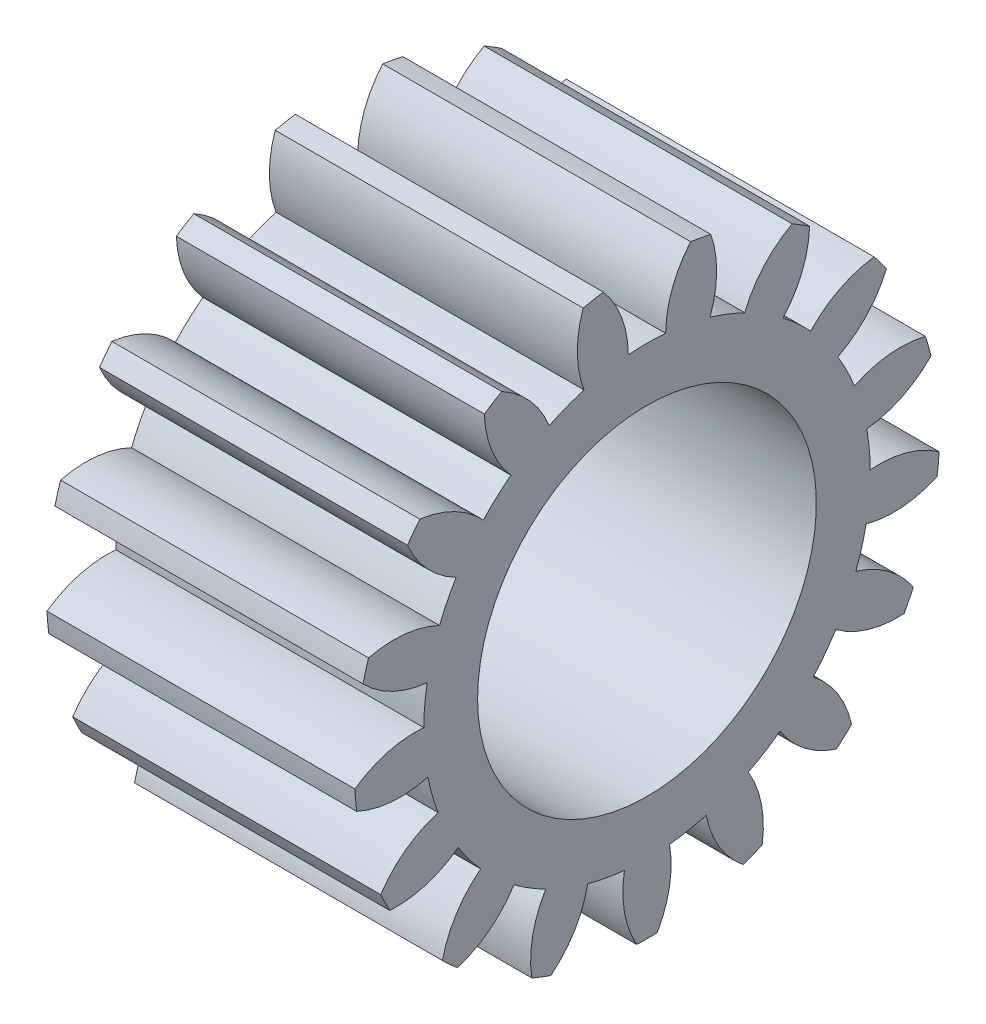
from build123d import *

# Parameters (mm, degrees)
BASPROSKE_W     = 10
BASPROSKE_H     = 9.5
TOOTHCUT_DEPTH  = 17.748134224
TEETHCUTS_COUNT = 17
TEETHCUTS_ANGLE = 338.823529412
BORSKE_R        = 5.5
BORE_DEPTH      = 50.0000508


with BuildPart() as part:
    # BasProSke → Base-Revolve (revolve)
    with BuildSketch(Plane(origin=(0, 0, 0), x_dir=(1, 0, 0), z_dir=(0, 1, 0)), mode=Mode.PRIVATE) as base_revolve_sk:
        with Locations((5, 4.75)):
            Rectangle(BASPROSKE_W, BASPROSKE_H)
    revolve(base_revolve_sk.sketch.rotate(Axis((-10, 0, 0), (1, 0, 0)), 180), axis=Axis((-10, 0, 0), (1, 0, 0)))

    # TooCutSke → ToothCut (cut, through all)
    with BuildSketch(Plane(origin=(0, 0, 0), x_dir=(0, 0, -1), z_dir=(1, 0, 0))):
        with BuildLine():
            ThreePointArc((0.605407802, 7.223675131), (0, 7.249), (-0.605407802, 7.223675131))
            ThreePointArc((-0.605407802, 7.223675131), (-0.825997975, 8.393988613), (-1.436647238, 9.416437218))
            ThreePointArc((-1.436647238, 9.416437218), (0, 9.5254), (1.436647238, 9.416437218))
            ThreePointArc((1.436647238, 9.416437218), (0.825997975, 8.393988613), (0.605407802, 7.223675131))
        make_face()
    toothcut = extrude(amount=TOOTHCUT_DEPTH, mode=Mode.SUBTRACT)

    # TeethCuts: ToothCut ×17 about axis
    teethcuts_axis = Axis((-10, 0, 0), (1, 0, 0))
    for i in range(1, TEETHCUTS_COUNT):
        add(toothcut.rotate(teethcuts_axis, i * TEETHCUTS_ANGLE / (TEETHCUTS_COUNT - 1)), mode=Mode.SUBTRACT)

    # BorSke → Bore (cut, symmetric)
    with BuildSketch(Plane(origin=(0, 0, 0), x_dir=(0, 0, -1), z_dir=(1, 0, 0))):
        with Locations(Location((0, 0, 0), (0, 0, 180))):
            Circle(BORSKE_R)
    extrude(amount=BORE_DEPTH, both=True, mode=Mode.SUBTRACT)


solid = part.part
